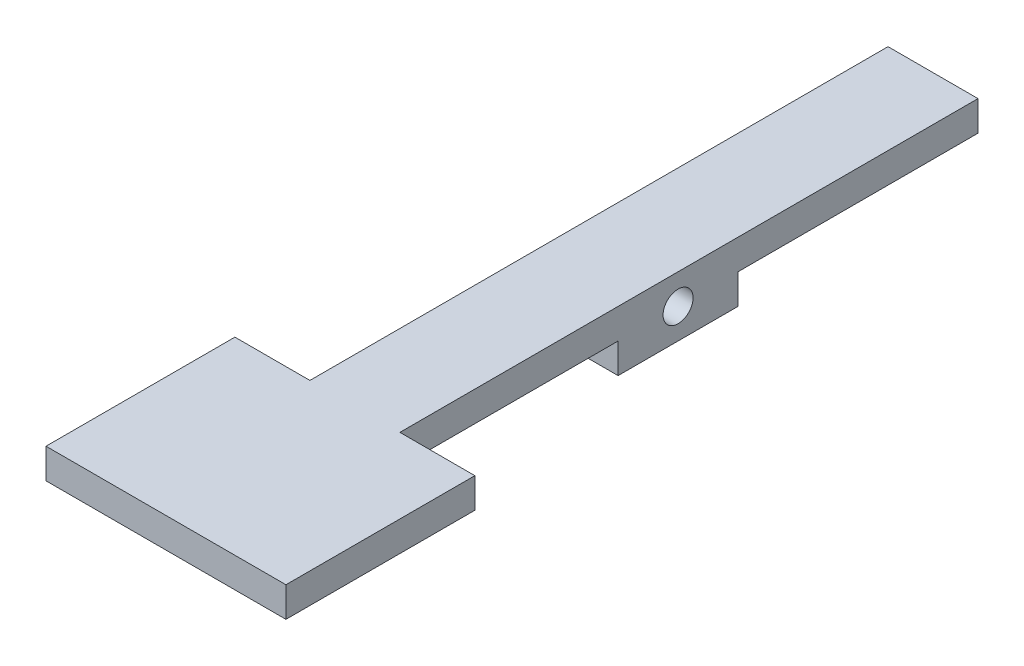
from build123d import *

# Parameters (mm, degrees)
SKETCH1_R           = 1.5875
BOSS_EXTRUDE1_DEPTH = 9.525
SKETCH3_W           = 15
SKETCH3_H           = 3.175
SKETCH3_W_2         = 5
BOSS_EXTRUDE2_DEPTH = 12.7


with BuildPart() as part:
    # Sketch1 → Boss-Extrude1 (new body)
    with BuildSketch(Plane(origin=(0, 0, 0), x_dir=(0, 0, -1), z_dir=(1, 0, 0))):
        Polygon((0, 1.5875), (0, -1.5875), (-25.4, -1.5875), (-25.4, -4.7625), (-38.1, -4.7625), (-38.1, -1.5875), (-76.2, -1.5875), (-76.2, 1.5875), align=None)
        with Locations(Location((-31.75, -1.5875, 0), (0, 0, 180))):
            Circle(SKETCH1_R, mode=Mode.SUBTRACT)
    extrude(amount=BOSS_EXTRUDE1_DEPTH)

    # Sketch3 → Boss-Extrude2 (add, symmetric)
    with BuildSketch(Plane(origin=(4.7625, 0, 0), x_dir=(0, 0, -1), z_dir=(1, 0, 0))):
        with Locations((-68.7, 0)):
            Rectangle(SKETCH3_W, SKETCH3_H)
        with Locations((-78.7, 0)):
            Rectangle(SKETCH3_W_2, SKETCH3_H)
    extrude(amount=BOSS_EXTRUDE2_DEPTH, both=True)


solid = part.part
